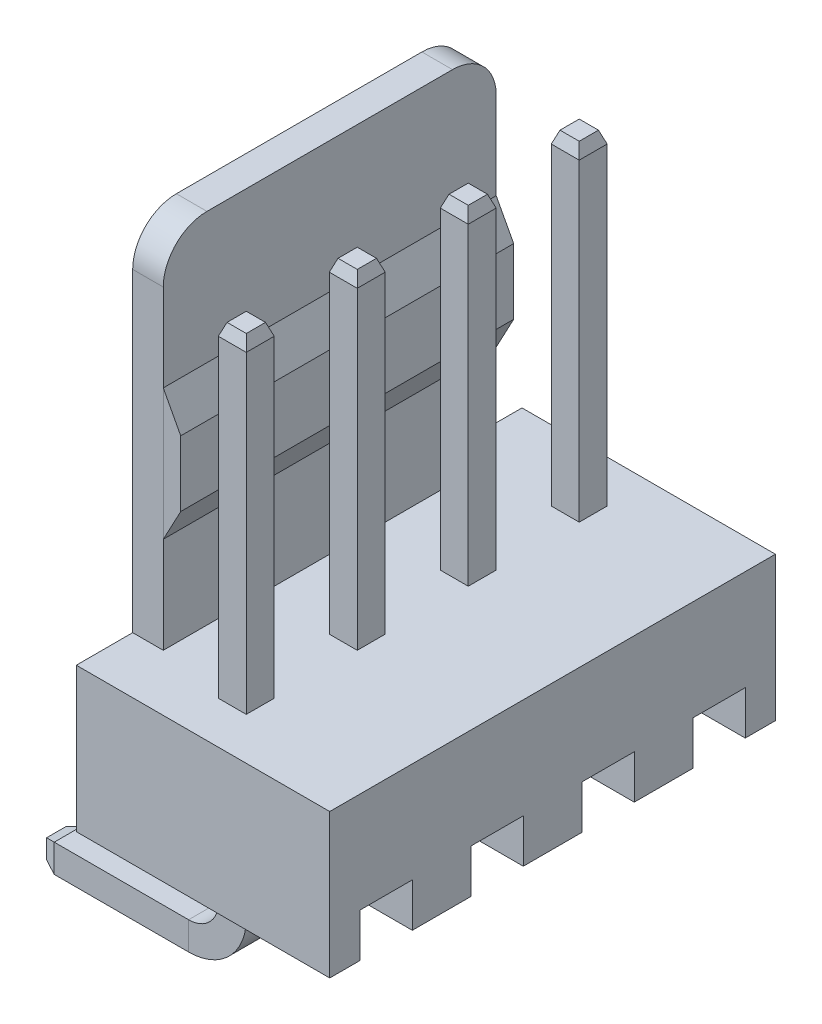
from build123d import *

# Parameters (mm, degrees)
SKETCH_1_W             = 0.64
SKETCH_1_H             = 0.64
CHAMFER_1_SIZE         = 0.1
CHAMFER_1_SIZE2        = 0.274747742
CHAMFER_2_SIZE         = 0.1
CHAMFER_2_SIZE2        = 0.274747742
PATTERN_LINEAR_2_COUNT = 3
PATTERN_LINEAR_2_PITCH = 2.54
PATTERN_LINEAR_3_COUNT = 2
PATTERN_LINEAR_3_PITCH = 2.54
EXTRUDE_1_DEPTH        = 5.8
EXTRUDE_2_DEPTH        = 0.7
EXTRUDE_3_DEPTH        = 7.62


with BuildPart() as part:
    # По траектории1: sweep along a curve in space
    with BuildLine() as sweep_1_path:
        Line((0, 0, 1.27), (-1.75, 0, 1.27))
        Line((0, 0, 1.27), (1.6, 0, 1.27))
        ThreePointArc((1.6, 0, 1.27), (2.307106781, 0.292893219, 1.27), (2.6, 1, 1.27))
        Line((2.6, 1, 1.27), (2.6, 12.5, 1.27))
    # Эскиз1 → По траектории1 (sweep)
    with BuildSketch(Plane(origin=(0, 0, 0), x_dir=(0, 0, -1), z_dir=(1, 0, 0))):
        with Locations((-1.27, 0)):
            Rectangle(SKETCH_1_W, SKETCH_1_H)
    sweep(path=sweep_1_path.line)

    # Фаска1
    chamfer_1_edges = [part.edges().sort_by_distance(p)[0] for p in [
        (2.92, 12.5, 1.27),
        (2.6, 12.5, 0.95),
        (2.28, 12.5, 1.27),
        (2.6, 12.5, 1.59),
    ]]
    chamfer_1_side = [part.faces().sort_by_distance(p)[0] for p in [
        (2.6, 12.5, 1.27),
    ]]
    chamfer(chamfer_1_edges, length=CHAMFER_1_SIZE, length2=CHAMFER_1_SIZE2, reference=chamfer_1_side[0])

    # Фаска2
    chamfer_2_edges = [part.edges().sort_by_distance(p)[0] for p in [
        (-1.75, 0, 1.59),
        (-1.75, -0.32, 1.27),
        (-1.75, 0, 0.95),
        (-1.75, 0.32, 1.27),
    ]]
    chamfer_2_side = [part.faces().sort_by_distance(p)[0] for p in [
        (-1.75, 0, 1.27),
    ]]
    chamfer(chamfer_2_edges, length=CHAMFER_2_SIZE, length2=CHAMFER_2_SIZE2, reference=chamfer_2_side[0])


with BuildPart() as pattern_linear_2_1:
    # Линейный массив2: pattern copy
    add(part.part.moved(Location(Vector(0, 0, -1) * (1 * PATTERN_LINEAR_2_PITCH))))


with BuildPart() as pattern_linear_2_2:
    # Линейный массив2: pattern copy
    add(part.part.moved(Location(Vector(0, 0, -1) * (2 * PATTERN_LINEAR_2_PITCH))))


with BuildPart() as pattern_linear_3_1:
    # Линейный массив3: pattern copy
    add(part.part.moved(Location(Vector(0, 0, 1) * (1 * PATTERN_LINEAR_3_PITCH))))


with BuildPart() as body_5:
    # Эскиз2 → Бобышка-Вытянуть1 (new body)
    with BuildSketch(Plane(origin=(0, 0, 0), x_dir=(0, 0, -1), z_dir=(1, 0, 0))):
        Polygon((1.87, 2.75), (1.87, 1.75), (3.21, 1.75), (3.21, 2.75), (4.41, 2.75), (4.41, 1.75), (5.1, 1.75), (5.1, 5.05), (-5.1, 5.05), (-5.1, 1.75), (-4.41, 1.75), (-4.41, 2.75), (-3.21, 2.75), (-3.21, 1.75), (-1.87, 1.75), (-1.87, 2.75), (-0.67, 2.75), (-0.67, 1.75), (0.67, 1.75), (0.67, 2.75), align=None)
    extrude(amount=EXTRUDE_1_DEPTH)


with BuildPart() as body_6:
    # Эскиз3 → Бобышка-Вытянуть2 (new body)
    with BuildSketch(Plane.ZY):
        with BuildLine():
            Line((-3.81, 5.05), (3.81, 5.05))
            Line((3.81, 5.05), (3.81, 12.25))
            ThreePointArc((3.81, 12.25), (3.517106781, 12.957106781), (2.81, 13.25))
            Line((2.81, 13.25), (-2.81, 13.25))
            ThreePointArc((-2.81, 13.25), (-3.517106781, 12.957106781), (-3.81, 12.25))
            Line((-3.81, 12.25), (-3.81, 5.05))
        make_face()
    extrude(amount=-EXTRUDE_2_DEPTH)


with BuildPart() as body_7:
    # Эскиз4 → Бобышка-Вытянуть3 (new body)
    with BuildSketch(Plane(origin=(0, 0, -3.81), x_dir=(-1, 0, 0), z_dir=(0, 0, -1))):
        Polygon((-0.7, 7.251063618), (-1.1, 8.001063618), (-1.1, 9.501063618), (-0.7, 10.251063618), align=None)
    extrude(amount=-EXTRUDE_3_DEPTH)


solid = Compound([part.part, pattern_linear_2_1.part, pattern_linear_2_2.part, pattern_linear_3_1.part, body_5.part, body_6.part, body_7.part])
